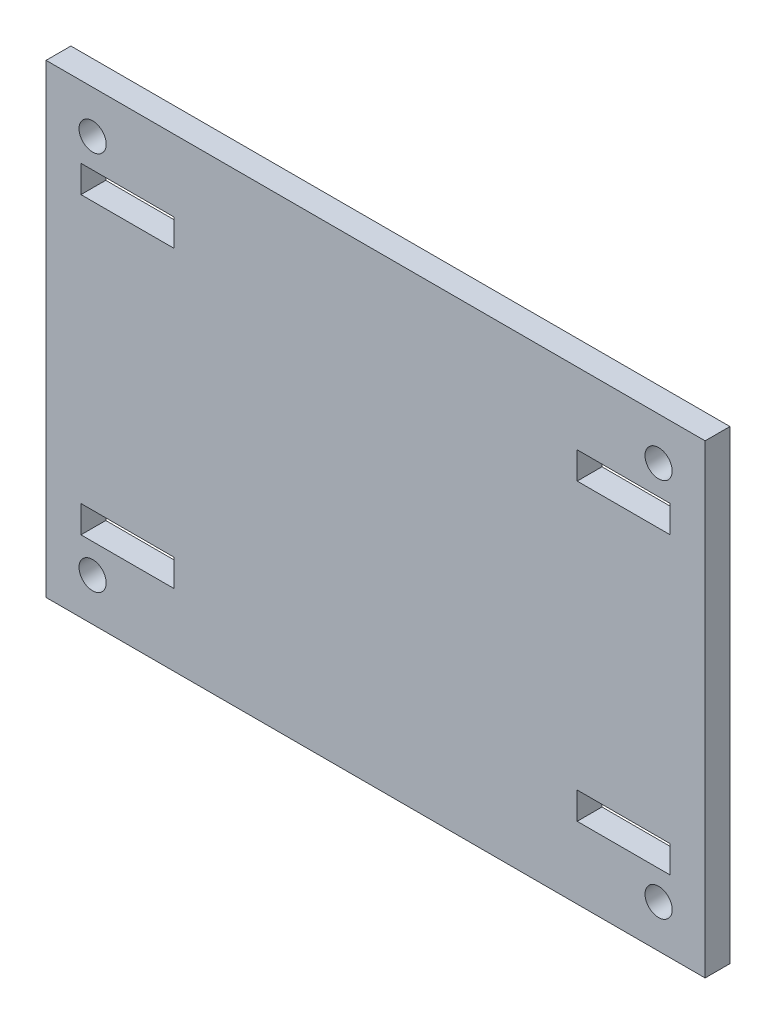
from build123d import *

# Parameters (mm, degrees)
SKETCH1_W              = 85
SKETCH1_H              = 60
SKETCH1_R              = 1.75
SKETCH1_W_2            = 12
SKETCH1_H_2            = 3.5
ELECTRONICS_DECK_DEPTH = 3.2


with BuildPart() as part:
    # Sketch1 → Electronics deck (new body)
    with BuildSketch(Plane.XY):
        Rectangle(SKETCH1_W, SKETCH1_H)
        with Locations((-36.5, -24.5)):
            Circle(SKETCH1_R, mode=Mode.SUBTRACT)
        with Locations((36.5, -24.5)):
            Circle(SKETCH1_R, mode=Mode.SUBTRACT)
        with Locations((-36.5, 24.5)):
            Circle(SKETCH1_R, mode=Mode.SUBTRACT)
        with Locations((36.5, 24.5)):
            Circle(SKETCH1_R, mode=Mode.SUBTRACT)
        with Locations((-32, 19)):
            Rectangle(SKETCH1_W_2, SKETCH1_H_2, mode=Mode.SUBTRACT)
        with Locations((32, 19)):
            Rectangle(SKETCH1_W_2, SKETCH1_H_2, mode=Mode.SUBTRACT)
        with Locations((-32, -19)):
            Rectangle(SKETCH1_W_2, SKETCH1_H_2, mode=Mode.SUBTRACT)
        with Locations((32, -19)):
            Rectangle(SKETCH1_W_2, SKETCH1_H_2, mode=Mode.SUBTRACT)
    extrude(amount=ELECTRONICS_DECK_DEPTH)


solid = part.part
